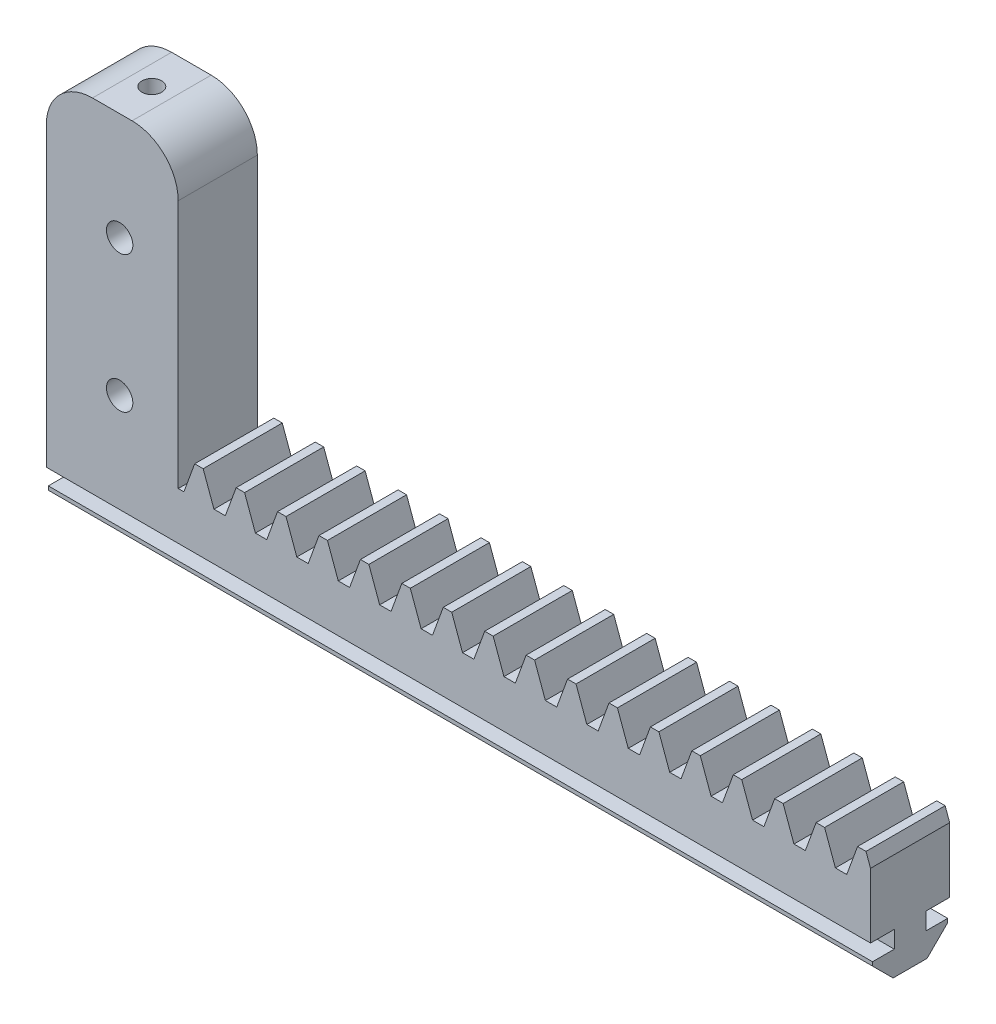
from build123d import *

# Parameters (mm, degrees)
BLANKSKE_W          = 105
BLANKSKE_H          = 18
BLANK_DEPTH         = 12
TOOTHCUTSIM_DEPTH   = 108.205410311
TEETHCUTS_COUNT     = 18
TEETHCUTS_PITCH     = 6.2831853
CUT_EXTRUDE1_DEPTH  = 108.205410311
BOSS_EXTRUDE1_DEPTH = 20
FILLET2_R           = 7
CUT_EXTRUDE2_DEPTH  = 9
CUT_EXTRUDE3_DEPTH  = 3
CUT_EXTRUDE4_REACH  = 122.698
SKETCH5_R           = 2


with BuildPart() as part:
    # BlankSke → Blank (new body)
    with BuildSketch(Plane.XY):
        with Locations((52.5, 9)):
            Rectangle(BLANKSKE_W, BLANKSKE_H)
    extrude(amount=-BLANK_DEPTH)

    # TooCutSkeSim → ToothCutSim (cut, through all)
    with BuildSketch(Plane.XY):
        Polygon((0.861870739, 13.5), (-0.861870739, 13.5), (-2.508981637, 18.0254), (2.508981637, 18.0254), align=None)
    toothcutsim = extrude(amount=-TOOTHCUTSIM_DEPTH, mode=Mode.SUBTRACT)

    # TeethCuts: ToothCutSim ×18
    with Locations(*[(i * TEETHCUTS_PITCH, 0, 0) for i in range(1, TEETHCUTS_COUNT)]):
        add(toothcutsim, mode=Mode.SUBTRACT)

    # Sketch1 → Cut-Extrude1 (cut, through all)
    with BuildSketch(Plane(origin=(105, 0, 0), x_dir=(0, 0, -1), z_dir=(1, 0, 0))):
        Polygon((0, 0), (3.424264069, 0), (0.3, 3.124264069), (0.3, 3.7), (3.6, 3.7), (3.6, 6.3), (0, 6.3), align=None)
        Polygon((11.7, 3.124264069), (8.575735931, 0), (12, 0), (12, 6.3), (8.4, 6.3), (8.4, 3.7), (11.7, 3.7), align=None)
    extrude(amount=-CUT_EXTRUDE1_DEPTH, mode=Mode.SUBTRACT)

    # Sketch2 → Boss-Extrude1 (add)
    with BuildSketch(Plane.ZY):
        Polygon((-12, 58.3), (0, 58.3), (0, 6.3), (-3.6, 6.3), (-3.6, 3.7), (-0.3, 3.7), (-0.3, 3.124264069), (-3.424264069, 0), (-8.575735931, 0), (-11.7, 3.124264069), (-11.7, 3.7), (-8.4, 3.7), (-8.4, 6.3), (-12, 6.3), align=None)
    extrude(amount=BOSS_EXTRUDE1_DEPTH)

    # Fillet2
    fillet2_edges = [part.edges().sort_by_distance(p)[0] for p in [
        (0, 58.3, -6),
        (-20, 58.3, -6),
    ]]
    fillet(fillet2_edges, radius=FILLET2_R)

    # Sketch3 → Cut-Extrude2 (cut)
    with BuildSketch(Plane(origin=(0, 58.3, 0), x_dir=(1, 0, 0), z_dir=(0, 1, 0))):
        with BuildLine():
            ThreePointArc((-8.5, 6), (-8.939339828, 7.060660172), (-10, 7.5))
            Line((-10, 7.5), (-10, 4.5))
            ThreePointArc((-10, 4.5), (-8.939339828, 4.939339828), (-8.5, 6))
        make_face()
        with BuildLine():
            Line((-10, 4.5), (-10, 7.5))
            ThreePointArc((-10, 7.5), (-11.5, 6), (-10, 4.5))
        make_face()
    extrude(amount=-CUT_EXTRUDE2_DEPTH, mode=Mode.SUBTRACT)

    # Sketch4 → Cut-Extrude3 (cut)
    with BuildSketch(Plane(origin=(0, 54.3, 0), x_dir=(1, 0, 0), z_dir=(0, 1, 0))):
        Polygon((-13.05, 12), (-13.05, 7.760918321), (-13.05, 6), (-13.05, 4.239081679), (-11.525, 3.358622518), (-10, 2.478163358), (-8.475, 3.358622518), (-6.95, 4.239081679), (-6.95, 6), (-6.95, 7.760918321), (-6.95, 12), align=None)
        with BuildLine():
            ThreePointArc((-8.75, 6), (-10, 4.75), (-11.25, 6))
            ThreePointArc((-11.25, 6), (-10, 7.25), (-8.75, 6))
        make_face(mode=Mode.SUBTRACT)
    extrude(amount=-CUT_EXTRUDE3_DEPTH, mode=Mode.SUBTRACT)

    # Sketch5 → Cut-Extrude4 (cut, up to next)
    with BuildSketch(Plane.XY, mode=Mode.PRIVATE) as cut_extrude4_sk1:
        with Locations((-8.8817, 42)):
            Circle(SKETCH5_R)
    cut_extrude4_tool1 = extrude(cut_extrude4_sk1.sketch, amount=-CUT_EXTRUDE4_REACH, mode=Mode.PRIVATE) & part.part
    # Sketch5 → Cut-Extrude4 (cut, up to next)
    with BuildSketch(Plane.XY, mode=Mode.PRIVATE) as cut_extrude4_sk2:
        with Locations((-8.8817, 21.3)):
            Circle(SKETCH5_R)
    cut_extrude4_tool2 = extrude(cut_extrude4_sk2.sketch, amount=-CUT_EXTRUDE4_REACH, mode=Mode.PRIVATE) & part.part
    add(cut_extrude4_tool1.solids().sort_by_distance((-8.8817, 42, 0))[0], mode=Mode.SUBTRACT)
    add(cut_extrude4_tool2.solids().sort_by_distance((-8.8817, 21.3, 0))[0], mode=Mode.SUBTRACT)


solid = part.part
